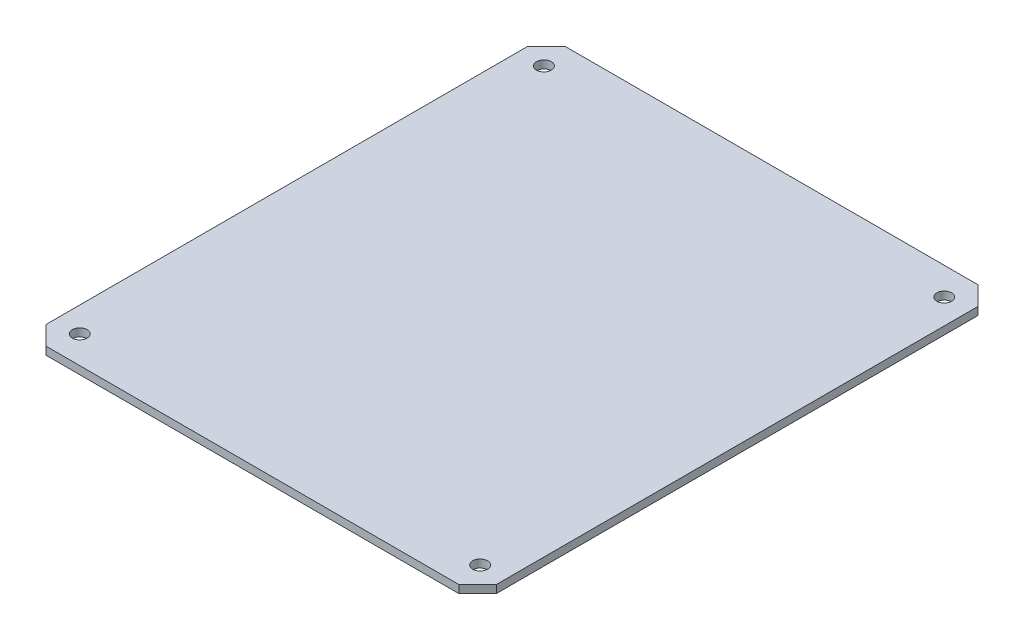
from build123d import *

# Parameters (mm, degrees)
REP_RES_R = 1.5
CI_DEPTH  = 1.6


with BuildPart() as part:
    # Repères → CI (new body)
    with BuildSketch(Plane(origin=(0, 0, 0), x_dir=(1, 0, 0), z_dir=(0, 1, 0))):
        Polygon((-41.91, 52.705), (-45.72, 48.895), (-45.72, -48.895), (-41.91, -52.705), (41.91, -52.705), (45.72, -48.895), (45.72, 48.895), (41.91, 52.705), align=None)
        with Locations(Location((-40.64, 47.117, 0), (0, 0, 270))):
            Circle(REP_RES_R, mode=Mode.SUBTRACT)
        with Locations(Location((40.64, 47.117, 0), (0, 0, 270))):
            Circle(REP_RES_R, mode=Mode.SUBTRACT)
        with Locations(Location((40.64, -47.117, 0), (0, 0, 270))):
            Circle(REP_RES_R, mode=Mode.SUBTRACT)
        with Locations(Location((-40.64, -47.117, 0), (0, 0, 270))):
            Circle(REP_RES_R, mode=Mode.SUBTRACT)
    extrude(amount=CI_DEPTH)


solid = part.part
